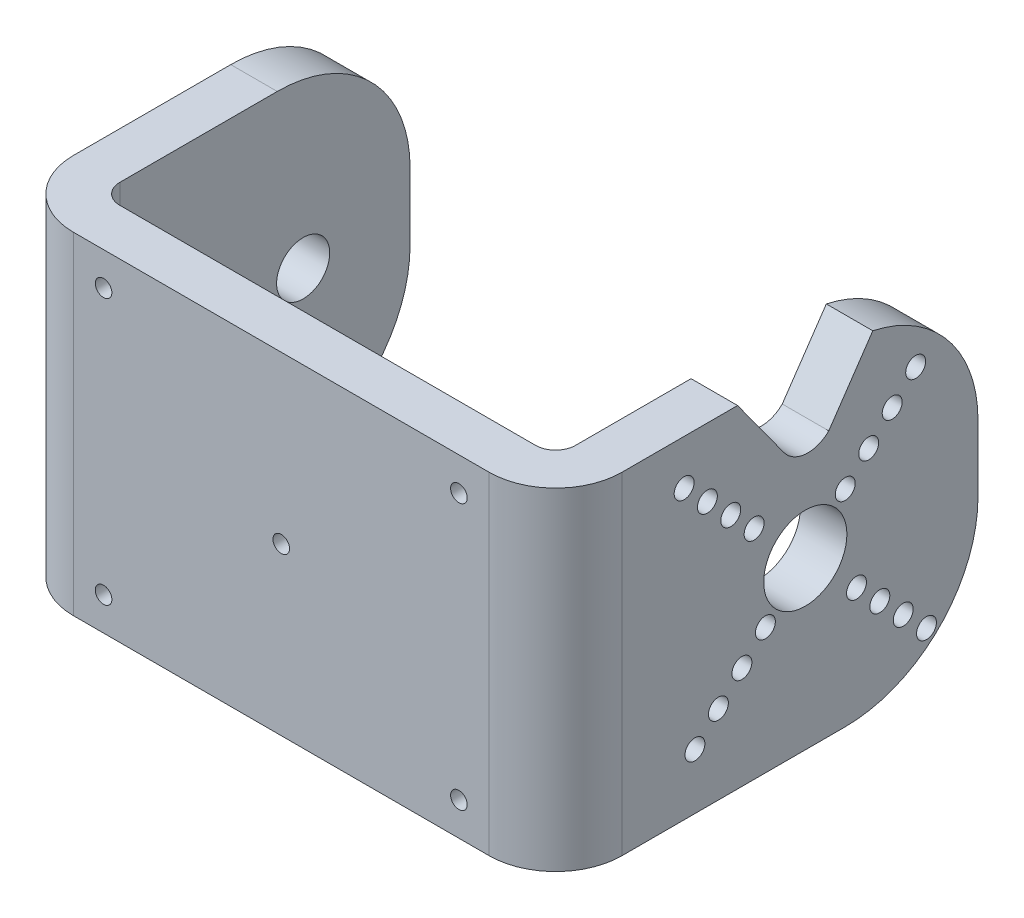
from build123d import *

# Parameters (mm, degrees)
BOSS_EXTRUDE1_DEPTH     = 50
FILLET2_R               = 20
SKETCH6_R               = 6.261637428
SKETCH6_R_2             = 1.5
CUT_EXTRUDE2_DEPTH      = 28.4
SKETCH6_3_R             = 4
CUT_EXTRUDE3_DEPTH      = 136.4
CUT_EXTRUDE4_DEPTH      = 116.893533958
CUT_EXTRUDE4_DEPTH_BACK = 26.4
SKETCH8_R               = 1.25
CUT_EXTRUDE5_DEPTH      = 5


with BuildPart() as part:
    # Sketch1 → Boss-Extrude1 (new body)
    with BuildSketch(Plane(origin=(0, 0, 0), x_dir=(1, 0, 0), z_dir=(0, 1, 0))):
        with BuildLine():
            Line((-56.375697839, 54.197981352), (-56.375697839, 10.497981352))
            ThreePointArc((-56.375697839, 10.497981352), (-53.44676565, 3.42691354), (-46.375697839, 0.497981352))
            Line((-46.375697839, 0.497981352), (16.224302161, 0.497981352))
            ThreePointArc((16.224302161, 0.497981352), (23.295369973, 3.42691354), (26.224302161, 10.497981352))
            Line((26.224302161, 10.497981352), (26.224302161, 64.097981352))
            Line((26.224302161, 64.097981352), (19.224302161, 64.097981352))
            Line((19.224302161, 64.097981352), (19.224302161, 10.497981352))
            ThreePointArc((19.224302161, 10.497981352), (18.345622505, 8.376661008), (16.224302161, 7.497981352))
            Line((16.224302161, 7.497981352), (-46.375697839, 7.497981352))
            ThreePointArc((-46.375697839, 7.497981352), (-48.497018182, 8.376661008), (-49.375697839, 10.497981352))
            Line((-49.375697839, 10.497981352), (-49.375697839, 54.197981352))
            Line((-49.375697839, 54.197981352), (-56.375697839, 54.197981352))
        make_face()
    extrude(amount=BOSS_EXTRUDE1_DEPTH)

    # Fillet2
    fillet2_edges = [part.edges().sort_by_distance(p)[0] for p in [
        (-52.875697839, 50, -54.197981352),
        (-52.875697839, 0, -54.197981352),
        (22.724302161, 0, -64.097981352),
        (22.724302161, 50, -64.097981352),
    ]]
    fillet(fillet2_edges, radius=FILLET2_R)

    # Sketch6 → Cut-Extrude2 (cut)
    with BuildSketch(Plane(origin=(26.224302161, 0, 0), x_dir=(0, 0, -1), z_dir=(1, 0, 0))):
        with Locations((38.097981352, 25)):
            Circle(SKETCH6_R)
        with Locations((19.854626397, 43.243354955)):
            Circle(SKETCH6_R_2)
        with Locations((23.354804964, 39.743176388)):
            Circle(SKETCH6_R_2)
        with Locations((26.876196734, 36.221784617)):
            Circle(SKETCH6_R_2)
        with Locations((30.390517437, 32.707463915)):
            Circle(SKETCH6_R_2)
        with Locations((32.087573711, 18.98959236)):
            Circle(SKETCH6_R_2)
        with Locations((28.552039805, 15.454058454)):
            Circle(SKETCH6_R_2)
        with Locations((25.0165059, 11.918524548)):
            Circle(SKETCH6_R_2)
        with Locations((21.480971994, 8.382990642)):
            Circle(SKETCH6_R_2)
        with Locations((44.108388992, 31.01040764)):
            Circle(SKETCH6_R_2)
        with Locations((47.643922898, 34.545941546)):
            Circle(SKETCH6_R_2)
        with Locations((51.179456803, 38.081475452)):
            Circle(SKETCH6_R_2)
        with Locations((54.714990709, 41.617009358)):
            Circle(SKETCH6_R_2)
        with Locations((56.341336306, 6.756645045)):
            Circle(SKETCH6_R_2)
        with Locations((52.841157739, 10.256823612)):
            Circle(SKETCH6_R_2)
        with Locations((49.319765969, 13.778215383)):
            Circle(SKETCH6_R_2)
        with Locations((45.805445266, 17.292536085)):
            Circle(SKETCH6_R_2)
    extrude(amount=-CUT_EXTRUDE2_DEPTH, mode=Mode.SUBTRACT)

    # Sketch6<3> → Cut-Extrude3 (cut)
    with BuildSketch(Plane(origin=(26.224302161, 0, 0), x_dir=(0, 0, -1), z_dir=(1, 0, 0))):
        with Locations((38.097981352, 25)):
            Circle(SKETCH6_3_R)
    extrude(amount=-CUT_EXTRUDE3_DEPTH, mode=Mode.SUBTRACT)

    # Sketch7 → Cut-Extrude4 (cut, two sides: drawn at the far end of the back side and taken through both)
    with BuildSketch(Plane(origin=(26.224302161, 0, 0), x_dir=(0, 0, -1), z_dir=(1, 0, 0)).offset(-CUT_EXTRUDE4_DEPTH_BACK)):
        with BuildLine():
            Line((44.097981352, 50), (27.901409821, 50))
            Line((27.901409821, 50), (34.889942889, 40.363586132))
            ThreePointArc((34.889942889, 40.363586132), (38.136702541, 38.542544558), (41.629478365, 39.830239282))
            Line((41.629478365, 39.830239282), (48.26230961, 49.561655609))
            ThreePointArc((48.26230961, 49.561655609), (46.191648926, 49.890112018), (44.097981352, 50))
        make_face()
    extrude(amount=CUT_EXTRUDE4_DEPTH + CUT_EXTRUDE4_DEPTH_BACK, mode=Mode.SUBTRACT)

    # Sketch8 → Cut-Extrude5 (cut)
    with BuildSketch(Plane.XY.offset(-0.497981352)):
        with Locations((-41.825697839, 45)):
            Circle(SKETCH8_R)
        with Locations((11.674302161, 45)):
            Circle(SKETCH8_R)
        with Locations((-15.075697839, 25)):
            Circle(SKETCH8_R)
        with Locations((-41.825697839, 5)):
            Circle(SKETCH8_R)
        with Locations((11.674302161, 5)):
            Circle(SKETCH8_R)
    extrude(amount=-CUT_EXTRUDE5_DEPTH, mode=Mode.SUBTRACT)


solid = part.part
